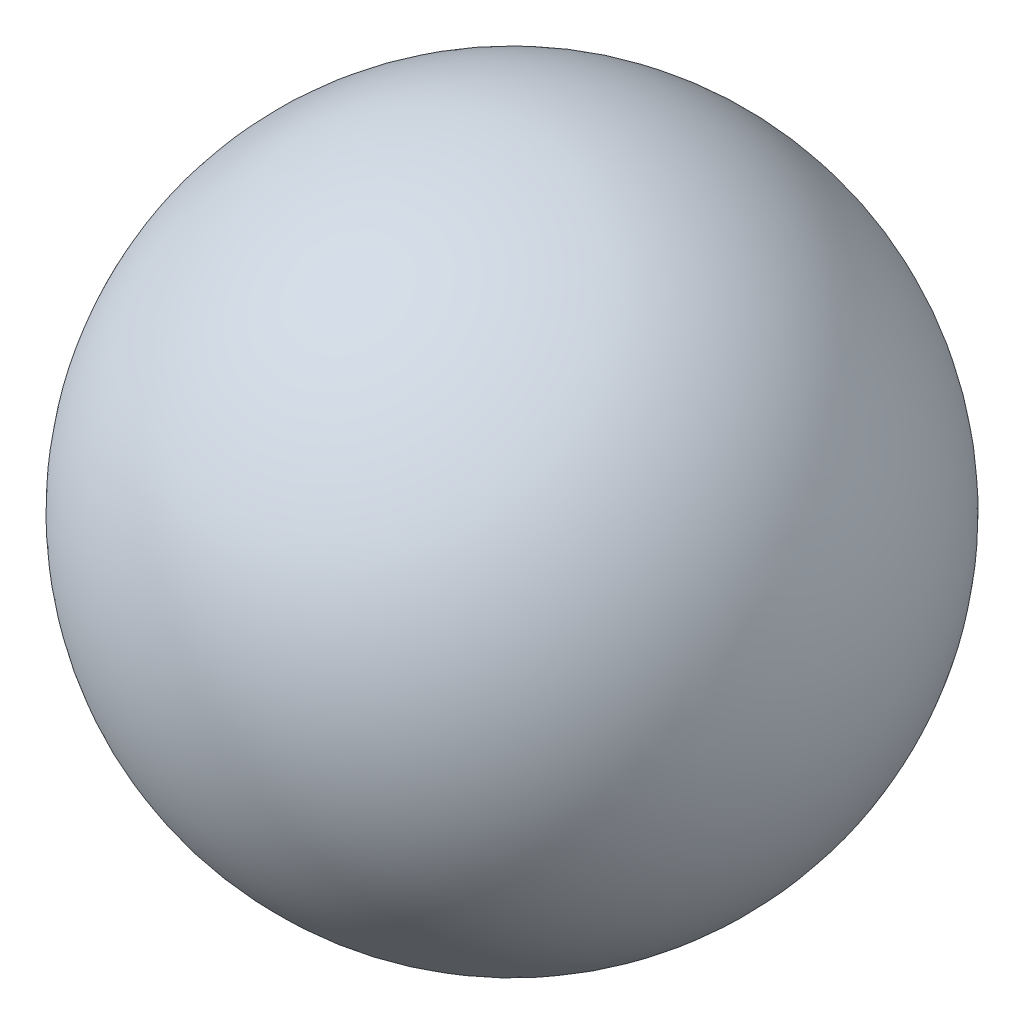
from build123d import *


with BuildPart() as part:
    # Esquisse1 → Révolution1 (revolve)
    with BuildSketch(Plane(origin=(0, 0, 0), x_dir=(1, 0, 0), z_dir=(0, 1, 0))):
        with BuildLine():
            Line((-6.35, 0), (6.35, 0))
            ThreePointArc((6.35, 0), (0, -6.35), (-6.35, 0))
        make_face()
    revolve(axis=Axis((-6.35, 0, 0), (1, 0, 0)))


solid = part.part
